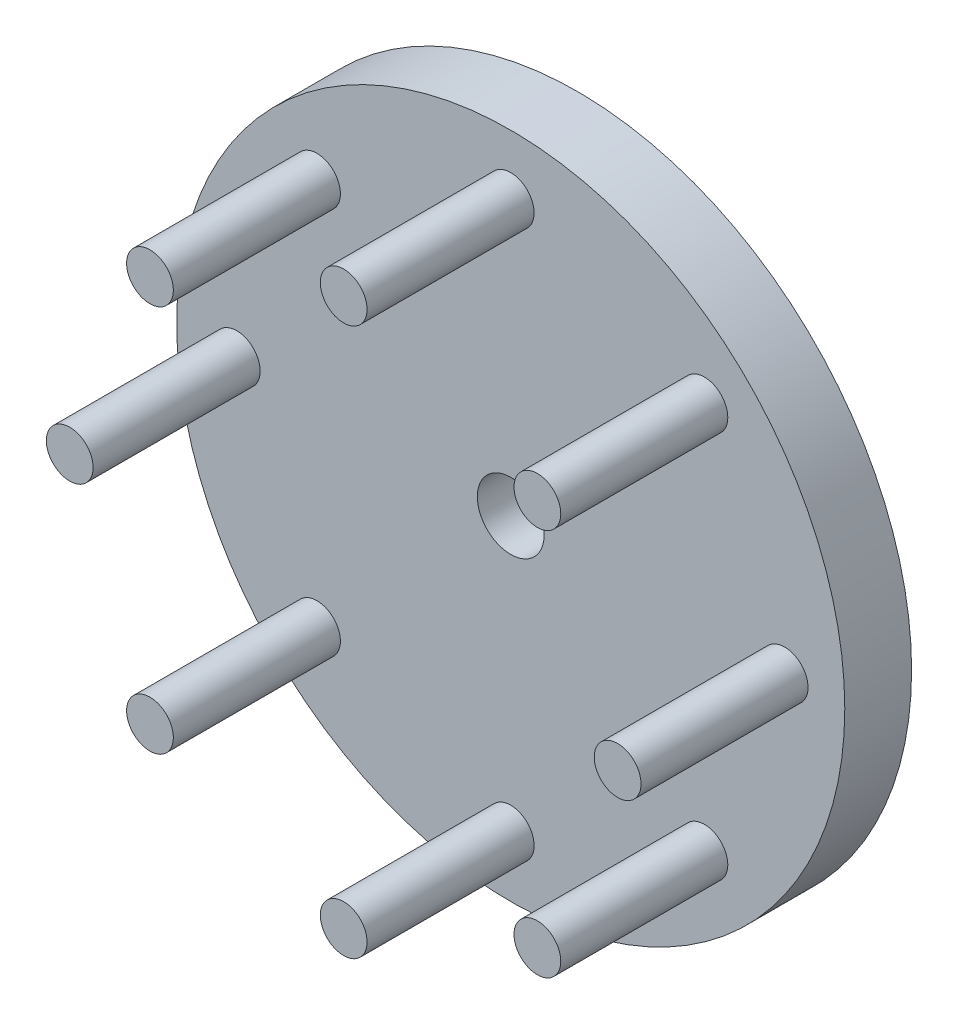
from build123d import *

# Parameters (mm, degrees)
SKETCH1_R           = 50
SKETCH1_R_2         = 5
BOSS_EXTRUDE1_DEPTH = 10
SKETCH2_R           = 3.5
BOSS_EXTRUDE2_DEPTH = 25


with BuildPart() as part:
    # Sketch1 → Boss-Extrude1 (new body)
    with BuildSketch(Plane.XY):
        Circle(SKETCH1_R)
        Circle(SKETCH1_R_2, mode=Mode.SUBTRACT)
    extrude(amount=BOSS_EXTRUDE1_DEPTH)

    # Sketch2 → Boss-Extrude2 (add)
    with BuildSketch(Plane.XY.offset(10)):
        with Locations((0, 41)):
            Circle(SKETCH2_R)
        with Locations((28.991378029, 28.991378029)):
            Circle(SKETCH2_R)
        with Locations((41, 0)):
            Circle(SKETCH2_R)
        with Locations((28.991378029, -28.991378029)):
            Circle(SKETCH2_R)
        with Locations((0, -41)):
            Circle(SKETCH2_R)
        with Locations((-28.991378029, -28.991378029)):
            Circle(SKETCH2_R)
        with Locations((-41, 0)):
            Circle(SKETCH2_R)
        with Locations((-28.991378029, 28.991378029)):
            Circle(SKETCH2_R)
    extrude(amount=BOSS_EXTRUDE2_DEPTH)


solid = part.part
